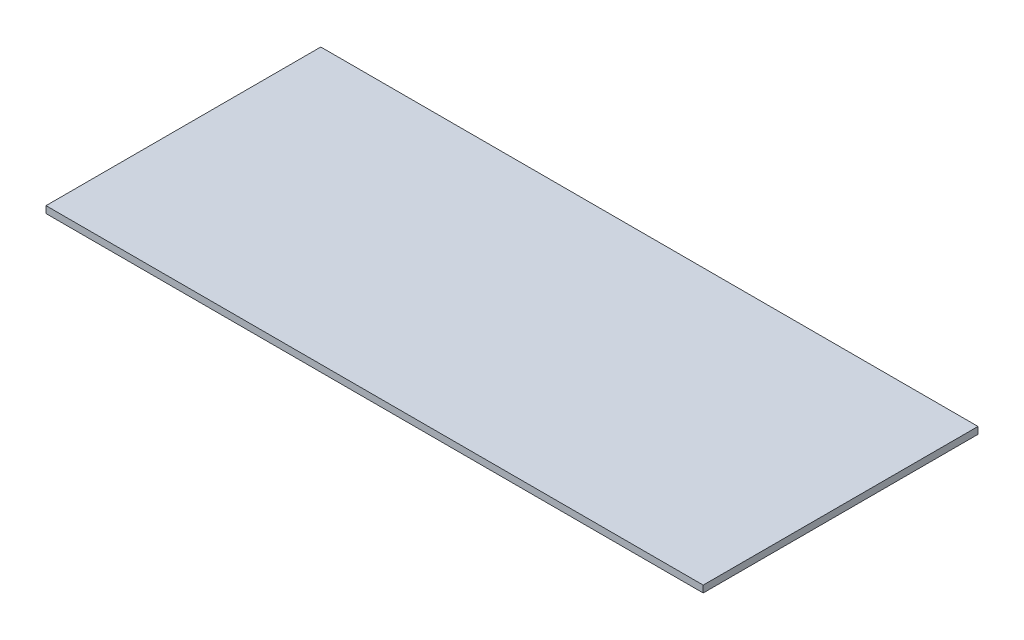
from build123d import *

# Parameters (mm, degrees)
SKETCH1_W           = 287
SKETCH1_H           = 120
BOSS_EXTRUDE1_DEPTH = 3


with BuildPart() as part:
    # Sketch1 → Boss-Extrude1 (new body)
    with BuildSketch(Plane(origin=(0, 0, 0), x_dir=(1, 0, 0), z_dir=(0, 1, 0))):
        Rectangle(SKETCH1_W, SKETCH1_H)
    extrude(amount=BOSS_EXTRUDE1_DEPTH)


solid = part.part
